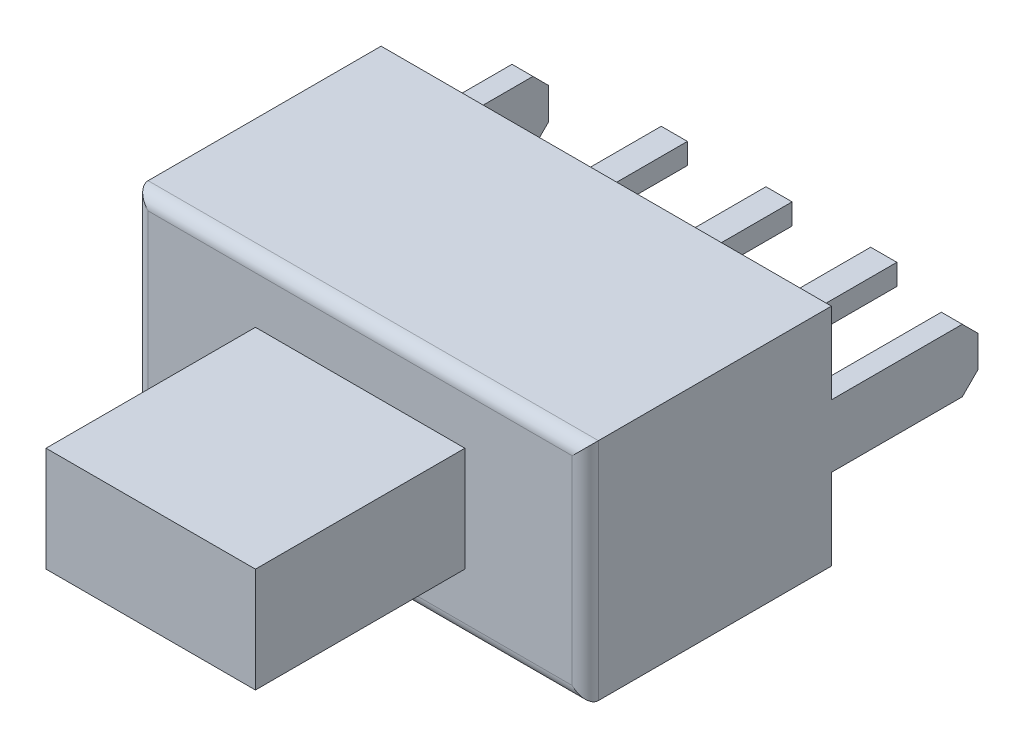
from build123d import *

# Parameters (mm, degrees)
SKETCH1_W           = 8.6
SKETCH1_H           = 4.3
BOSS_EXTRUDE1_DEPTH = 4.7
SKETCH2_W           = 4
SKETCH2_H           = 2
BOSS_EXTRUDE2_DEPTH = 4
SKETCH3_W           = 0.4
SKETCH3_H           = 1.2
BOSS_EXTRUDE3_DEPTH = 2.8
SKETCH4_W           = 0.5
SKETCH4_H           = 0.4
BOSS_EXTRUDE4_DEPTH = 3.3
CHAMFER1_SIZE       = 0.3
FILLET1_R           = 0.25


with BuildPart() as part:
    # Sketch1 → Boss-Extrude1 (new body)
    with BuildSketch(Plane.XY):
        Rectangle(SKETCH1_W, SKETCH1_H)
    extrude(amount=BOSS_EXTRUDE1_DEPTH)

    # Sketch2 → Boss-Extrude2 (add)
    with BuildSketch(Plane.XY.offset(4.7)):
        Rectangle(SKETCH2_W, SKETCH2_H)
    extrude(amount=BOSS_EXTRUDE2_DEPTH)

    # Sketch3 → Boss-Extrude3 (add)
    with BuildSketch(Plane(origin=(0, 0, 0), x_dir=(-1, 0, 0), z_dir=(0, 0, -1))):
        with Locations((-4.1, 0)):
            Rectangle(SKETCH3_W, SKETCH3_H)
        with Locations((4.1, 0)):
            Rectangle(SKETCH3_W, SKETCH3_H)
    extrude(amount=BOSS_EXTRUDE3_DEPTH)

    # Sketch4 → Boss-Extrude4 (add)
    with BuildSketch(Plane(origin=(0, 0, 0), x_dir=(-1, 0, 0), z_dir=(0, 0, -1))):
        with Locations((2, 0)):
            Rectangle(SKETCH4_W, SKETCH4_H)
        Rectangle(SKETCH4_W, SKETCH4_H)
        with Locations((-2, 0)):
            Rectangle(SKETCH4_W, SKETCH4_H)
    extrude(amount=BOSS_EXTRUDE4_DEPTH)

    # Chamfer1
    chamfer1_edges = [part.edges().sort_by_distance(p)[0] for p in [
        (4.1, 0.6, -2.8),
        (4.1, -0.6, -2.8),
        (-4.1, 0.6, -2.8),
        (-4.1, -0.6, -2.8),
    ]]
    chamfer(chamfer1_edges, length=CHAMFER1_SIZE)

    # Fillet1
    fillet1_edges = [part.edges().sort_by_distance(p)[0] for p in [
        (-4.3, 0, 4.7),
        (0, -2.15, 4.7),
        (4.3, 0, 4.7),
        (0, 2.15, 4.7),
    ]]
    fillet(fillet1_edges, radius=FILLET1_R)


solid = part.part
